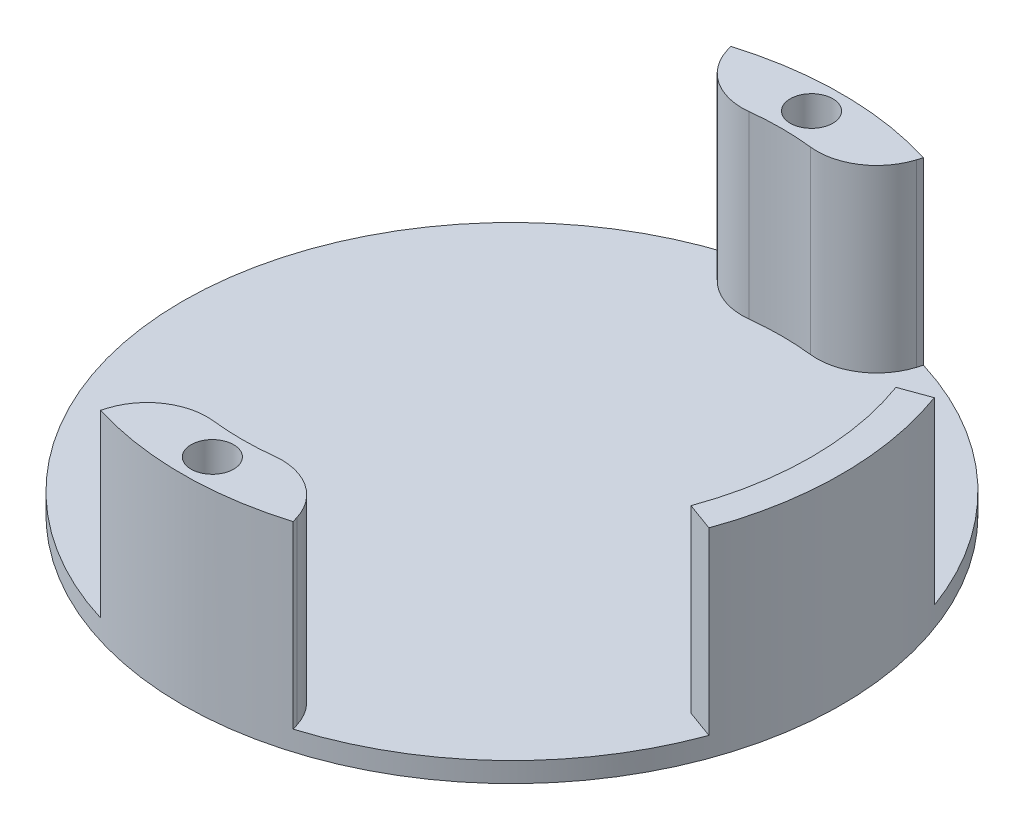
from build123d import *
from build123d.topology import SkipClean

# Parameters (mm, degrees)
SKETCH2_R               = 69.85
BOSS_EXTRUDE1_DEPTH     = 4.233333
BOSS_EXTRUDE2_DEPTH     = 38.1
FILLET3_R               = 12.7
FILLET4_R               = 12.7
FILLET5_R               = 12.7
BOSS_EXTRUDE3_DEPTH     = 38.1
CUT_EXTRUDE1_DEPTH      = 108.471653
CUT_EXTRUDE1_DEPTH_BACK = 108.471653
SKETCH5_R               = 4.5085
FILLET6_R               = 12.7


with BuildPart() as part:
    # Sketch2 → Boss-Extrude1 (new body)
    with BuildSketch(Plane(origin=(0, 0, 0), x_dir=(1, 0, 0), z_dir=(0, 1, 0))):
        with Locations(Location((0, 0, 0), (0, 0, 270))):
            Circle(SKETCH2_R)
    extrude(amount=BOSS_EXTRUDE1_DEPTH)

    # Sketch3 → Boss-Extrude2 (add)
    with BuildSketch(Plane(origin=(0, 4.233333, 0), x_dir=(1, 0, 0), z_dir=(0, 1, 0))):
        with BuildLine():
            Line((-16.709043, -54.652817), (-20.422164, -66.797887))
            ThreePointArc((-20.422164, -66.797887), (0, -69.85), (20.422164, -66.797887))
            Line((20.422164, -66.797887), (16.709043, -54.652817))
            ThreePointArc((16.709043, -54.652817), (0, -57.15), (-16.709043, -54.652817))
        make_face()
        with BuildLine():
            ThreePointArc((20.422164, 66.797887), (0, 69.85), (-20.422164, 66.797887))
            Line((-20.422164, 66.797887), (-16.709043, 54.652817))
            ThreePointArc((-16.709043, 54.652817), (0, 57.15), (16.709043, 54.652817))
            Line((16.709043, 54.652817), (20.422164, 66.797887))
        make_face()
    extrude(amount=BOSS_EXTRUDE2_DEPTH)

    # Fillet3
    fillet3_edges = [part.edges().sort_by_distance(p)[0] for p in [
        (-16.709043, 23.283333, -54.652817),
    ]]
    fillet(fillet3_edges, radius=FILLET3_R)

    # Fillet4
    fillet4_edges = [part.edges().sort_by_distance(p)[0] for p in [
        (16.709043, 23.283333, 54.652817),
    ]]
    fillet(fillet4_edges, radius=FILLET4_R)

    # Fillet5
    fillet5_edges = [part.edges().sort_by_distance(p)[0] for p in [
        (-16.709043, 23.283333, 54.652817),
    ]]
    fillet(fillet5_edges, radius=FILLET5_R)

    # Sketch4 → Boss-Extrude3 (add)
    with SkipClean():  # the faces are left unmerged after this step: merging them gives an invalid solid
        with BuildSketch(Plane(origin=(0, 4.233333, 0), x_dir=(1, 0, 0), z_dir=(0, 1, 0))):
            with BuildLine():
                Line((59.670481, 21.718279), (65.63753, 23.890107))
                ThreePointArc((65.63753, 23.890107), (69.85, 0), (65.63753, -23.890107))
                Line((65.63753, -23.890107), (59.670481, -21.718279))
                ThreePointArc((59.670481, -21.718279), (63.5, 0), (59.670481, 21.718279))
            make_face()
        extrude(amount=BOSS_EXTRUDE3_DEPTH)

    # Sketch5 → Cut-Extrude1 (cut, two sides: drawn at the far end of the back side and taken through both)
    with SkipClean():  # the faces are left unmerged after this step: merging them gives an invalid solid
        with BuildSketch(Plane(origin=(0, 42.333333, 0), x_dir=(1, 0, 0), z_dir=(0, 1, 0)).offset(-CUT_EXTRUDE1_DEPTH_BACK)):
            with Locations(Location((0, 63.5, 0), (0, 0, 270))):
                Circle(SKETCH5_R)
            with Locations(Location((0, -63.5, 0), (0, 0, 270))):
                Circle(SKETCH5_R)
        extrude(amount=CUT_EXTRUDE1_DEPTH + CUT_EXTRUDE1_DEPTH_BACK, mode=Mode.SUBTRACT)

    # Fillet6
    fillet6_edges = [part.edges().sort_by_distance(p)[0] for p in [
        (16.709043, 23.283333, -54.652817),
    ]]
    fillet(fillet6_edges, radius=FILLET6_R)


solid = part.part
